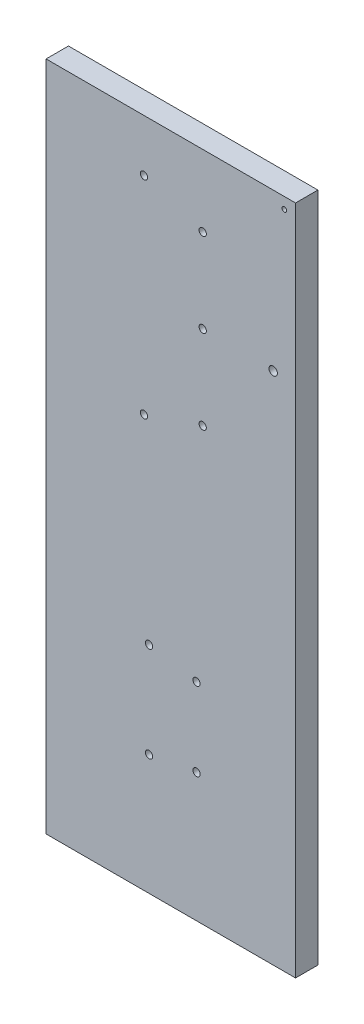
from build123d import *

# Parameters (mm, degrees)
SKETCH1_W                                           = 223
SKETCH1_H                                           = 600
BOSS_EXTRUDE1_DEPTH                                 = 20
CBORE_FOR_M6_HEX_SOCKET_HEAD_CAP_SCREW1_D           = 6.5
CBORE_FOR_M6_HEX_SOCKET_HEAD_CAP_SCREW1_CBORE_D     = 15
CBORE_FOR_M6_HEX_SOCKET_HEAD_CAP_SCREW1_CBORE_DEPTH = 10
CBORE_FOR_M6_HEX_SOCKET_HEAD_CAP_SCREW2_D           = 6.5
CBORE_FOR_M6_HEX_SOCKET_HEAD_CAP_SCREW2_CBORE_D     = 15
CBORE_FOR_M6_HEX_SOCKET_HEAD_CAP_SCREW2_CBORE_DEPTH = 10
SKETCH6_R                                           = 3.75
CUT_EXTRUDE1_DEPTH                                  = 641.413147898
M5_TAPPED_HOLE1_D                                   = 4.2
M5_TAPPED_HOLE1_DEPTH                               = 12.4
M5_TAPPED_HOLE1_TIP                                 = 1.2618073


with BuildPart() as part:
    # Sketch1 → Boss-Extrude1 (new body)
    with BuildSketch(Plane.XY):
        with Locations((111.5, 300)):
            Rectangle(SKETCH1_W, SKETCH1_H)
    extrude(amount=BOSS_EXTRUDE1_DEPTH)

    # CBORE for M6 Hex Socket Head Cap Screw1 (through all)
    with Locations(Plane(origin=(0, 0, 0), x_dir=(-1, 0, 0), z_dir=(0, 0, -1))):
        with Locations((-134.5, 115), (-134.5, 185), (-92, 107.5), (-92, 192.5)):
            CounterBoreHole(CBORE_FOR_M6_HEX_SOCKET_HEAD_CAP_SCREW1_D / 2, CBORE_FOR_M6_HEX_SOCKET_HEAD_CAP_SCREW1_CBORE_D / 2, CBORE_FOR_M6_HEX_SOCKET_HEAD_CAP_SCREW1_CBORE_DEPTH)

    # CBORE for M6 Hex Socket Head Cap Screw2 (through all)
    with Locations(Plane(origin=(0, 0, 0), x_dir=(-1, 0, 0), z_dir=(0, 0, -1))):
        with Locations((-87.5, 368.5), (-87.5, 553.5), (-140, 386), (-140, 461), (-140, 536)):
            CounterBoreHole(CBORE_FOR_M6_HEX_SOCKET_HEAD_CAP_SCREW2_D / 2, CBORE_FOR_M6_HEX_SOCKET_HEAD_CAP_SCREW2_CBORE_D / 2, CBORE_FOR_M6_HEX_SOCKET_HEAD_CAP_SCREW2_CBORE_DEPTH)

    # Sketch6 → Cut-Extrude1 (cut, through all)
    with BuildSketch(Plane.XY.offset(20)):
        with Locations((203, 460)):
            Circle(SKETCH6_R)
    extrude(amount=-CUT_EXTRUDE1_DEPTH, mode=Mode.SUBTRACT)

    # M5 Tapped Hole1
    with Locations(Plane.XY.offset(20)):
        with Locations((213, 590)):
            Hole(M5_TAPPED_HOLE1_D / 2, depth=M5_TAPPED_HOLE1_DEPTH)
            with Locations((0, 0, -(M5_TAPPED_HOLE1_DEPTH + M5_TAPPED_HOLE1_TIP / 2))):  # 118° drill point
                Cone(0, M5_TAPPED_HOLE1_D / 2, M5_TAPPED_HOLE1_TIP, mode=Mode.SUBTRACT)


solid = part.part
